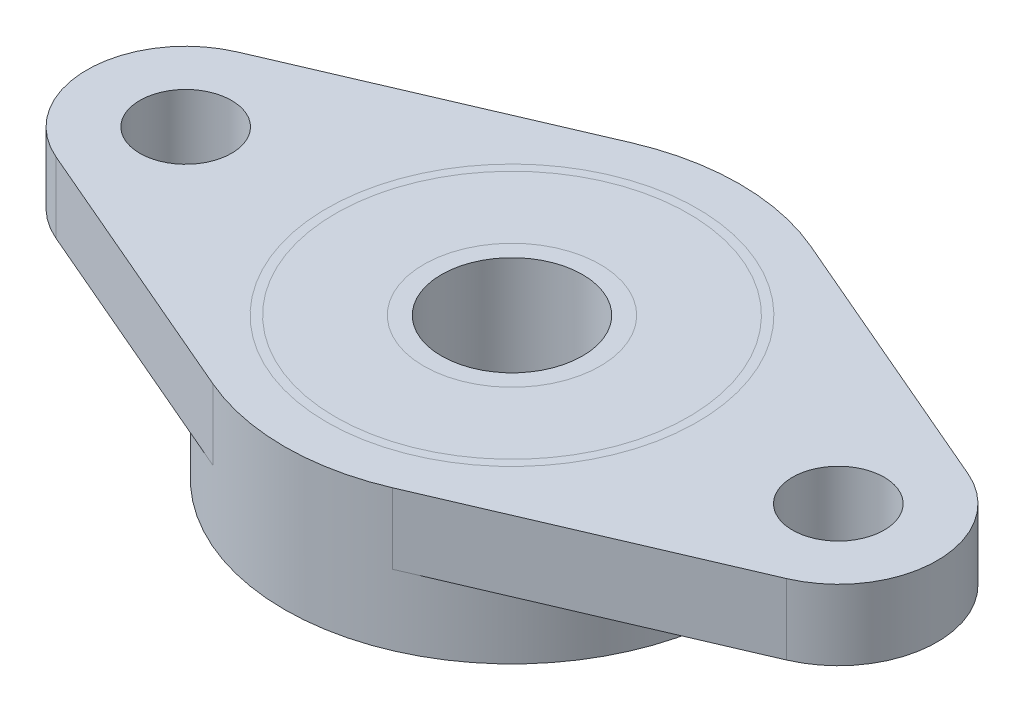
from build123d import *
from build123d.topology import SkipClean

# Parameters (mm, degrees)
SKETCH_1_R          = 2.6
SKETCH_1_R_2        = 4
EXTRUDE_1_DEPTH     = 4
EXTRUDE_START       = 4
SKETCH_2_R          = 12.9
SKETCH_2_R_2        = 4
EXTRUDE_2_DEPTH     = 4
EXTRUDE_START_2     = 3.5
SKETCH_3_R          = 6.1
SKETCH_3_R_2        = 4
EXTRUDE_3_DEPTH     = 3.5
SKETCH_6_R          = 1
CUT_EXTRUDE_1_DEPTH = 10
SKETCH_7_R          = 1
CUT_EXTRUDE_2_DEPTH = 10


with BuildPart() as part:
    # 草图1 → 凸台-拉伸1 (new body)
    with BuildSketch(Plane(origin=(0, 0, 0), x_dir=(1, 0, 0), z_dir=(0, 1, 0))):
        with BuildLine():
            Line((-20.70972973, -5.145589813), (-5.09027027, -11.853233676))
            ThreePointArc((-5.09027027, -11.853233676), (0, -12.9), (5.09027027, -11.853233676))
            Line((5.09027027, -11.853233676), (20.70972973, -5.145589813))
            ThreePointArc((20.70972973, -5.145589813), (24.1, 0), (20.70972973, 5.145589813))
            Line((20.70972973, 5.145589813), (5.09027027, 11.853233676))
            ThreePointArc((5.09027027, 11.853233676), (0, 12.9), (-5.09027027, 11.853233676))
            Line((-5.09027027, 11.853233676), (-20.70972973, 5.145589813))
            ThreePointArc((-20.70972973, 5.145589813), (-24.1, 0), (-20.70972973, -5.145589813))
        make_face()
        with Locations(Location((-18.5, 0, 0), (0, 0, 270))):
            Circle(SKETCH_1_R, mode=Mode.SUBTRACT)
        with Locations(Location((18.5, 0, 0), (0, 0, 90))):
            Circle(SKETCH_1_R, mode=Mode.SUBTRACT)
        with Locations(Location((0, 0, 0), (0, 0, 270))):
            Circle(SKETCH_1_R_2, mode=Mode.SUBTRACT)
    extrude(amount=EXTRUDE_1_DEPTH)

    # 草图2 → 凸台-拉伸2 (add)
    with SkipClean():  # the faces are left unmerged after this step: merging them gives an invalid solid
        with BuildSketch(Plane.XZ.offset(EXTRUDE_START)):
            with Locations(Location((0, 0, 0), (0, 0, 270))):
                Circle(SKETCH_2_R)
            with Locations(Location((0, 0, 0), (0, 0, 270))):
                Circle(SKETCH_2_R_2, mode=Mode.SUBTRACT)
        extrude(amount=-EXTRUDE_2_DEPTH)

    # 草图3 → 凸台-拉伸3 (add)
    with SkipClean():  # the faces are left unmerged after this step: merging them gives an invalid solid
        with BuildSketch(Plane.XZ.offset(4).offset(EXTRUDE_START_2)):
            with Locations(Location((0, 0, 0), (0, 0, 270))):
                Circle(SKETCH_3_R)
            with Locations(Location((0, 0, 0), (0, 0, 270))):
                Circle(SKETCH_3_R_2, mode=Mode.SUBTRACT)
        extrude(amount=-EXTRUDE_3_DEPTH)

    # 草图6 → 切除-拉伸1 (cut)
    with SkipClean():  # the faces are left unmerged after this step: merging them gives an invalid solid
        with BuildSketch(Plane.XY):
            with Locations(Location((0, -5.75, 0), (0, 0, 90))):
                Circle(SKETCH_6_R)
        extrude(amount=-CUT_EXTRUDE_1_DEPTH, mode=Mode.SUBTRACT)

    # 草图7 → 切除-拉伸2 (cut)
    with SkipClean():  # the faces are left unmerged after this step: merging them gives an invalid solid
        with BuildSketch(Plane(origin=(0, 0, 0), x_dir=(0, 0, -1), z_dir=(1, 0, 0))):
            with Locations((0, -5.75)):
                Circle(SKETCH_7_R)
        extrude(amount=-CUT_EXTRUDE_2_DEPTH, mode=Mode.SUBTRACT)


solid = part.part
